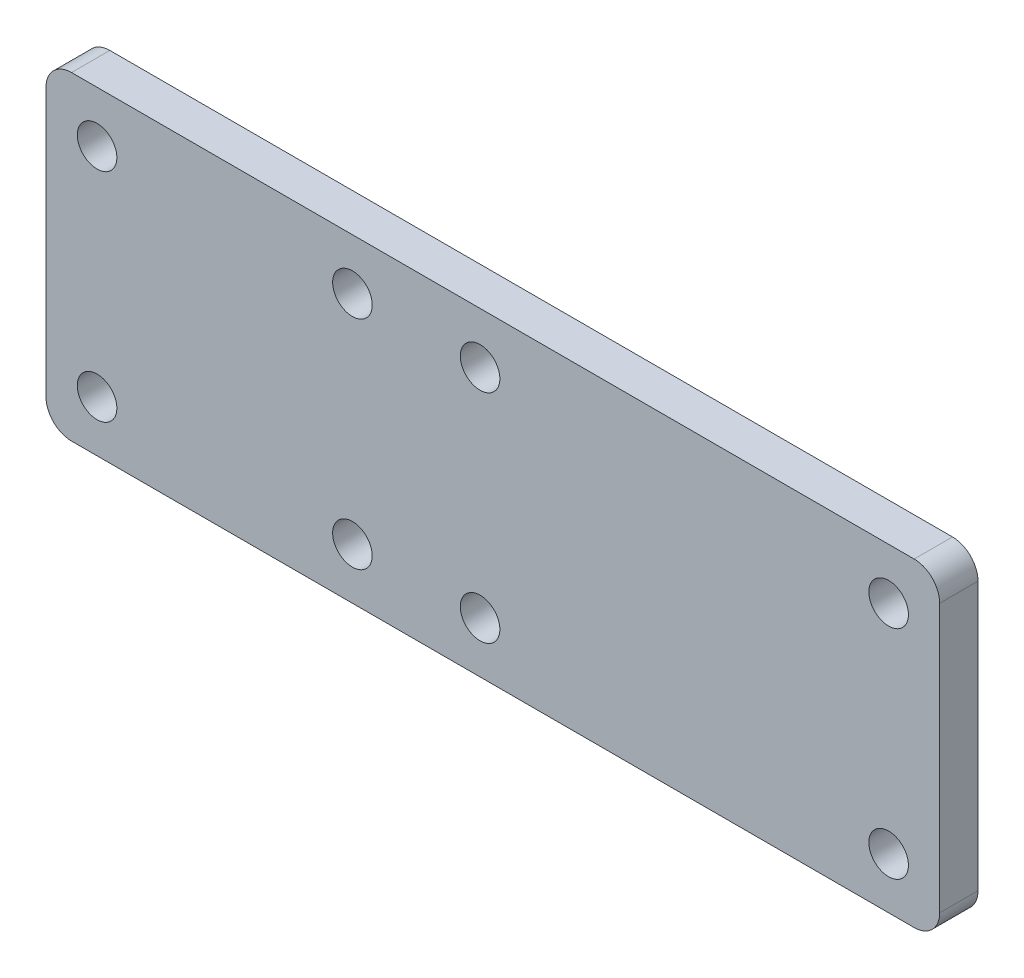
from build123d import *

# Parameters (mm, degrees)
SKETCH_1_W          = 70
SKETCH_1_H          = 25
EXTRUDE_1_DEPTH     = 3
SKETCH_2_R          = 1.55
CUT_EXTRUDE_1_DEPTH = 3
FILLET_1_R          = 2


with BuildPart() as part:
    # 草图1 → 凸台-拉伸1 (new body)
    with BuildSketch(Plane.XY):
        Rectangle(SKETCH_1_W, SKETCH_1_H)
    extrude(amount=EXTRUDE_1_DEPTH)

    # 草图2 → 切除-拉伸1 (cut)
    with BuildSketch(Plane.XY.offset(3)):
        with Locations((31, 8.5)):
            Circle(SKETCH_2_R)
        with Locations((-1, 8.5)):
            Circle(SKETCH_2_R)
        with Locations((-1, -8.5)):
            Circle(SKETCH_2_R)
        with Locations((31, -8.5)):
            Circle(SKETCH_2_R)
        with Locations((-11, -8.5)):
            Circle(SKETCH_2_R)
        with Locations((-31, -8.5)):
            Circle(SKETCH_2_R)
        with Locations((-31, 8.5)):
            Circle(SKETCH_2_R)
        with Locations((-11, 8.5)):
            Circle(SKETCH_2_R)
    extrude(amount=-CUT_EXTRUDE_1_DEPTH, mode=Mode.SUBTRACT)

    # 圆角1
    fillet_1_edges = [part.edges().sort_by_distance(p)[0] for p in [
        (35, -12.5, 1.5),
        (-35, -12.5, 1.5),
        (-35, 12.5, 1.5),
        (35, 12.5, 1.5),
    ]]
    fillet(fillet_1_edges, radius=FILLET_1_R)


solid = part.part
